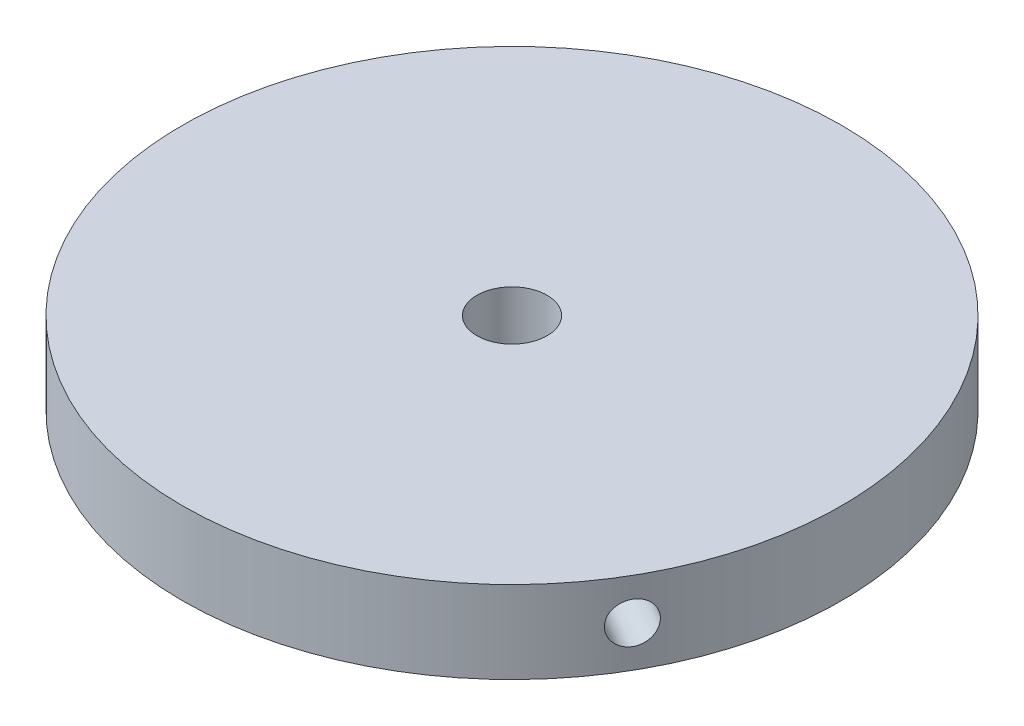
from build123d import *

# Parameters (mm, degrees)
SKETCH1_R           = 38.1508
BOSS_EXTRUDE1_DEPTH = 9.525
SKETCH4_R           = 2.3749
CUT_EXTRUDE2_DEPTH  = 6.35
CIRPATTERN1_COUNT   = 3
SKETCH6_R           = 4.064
CUT_EXTRUDE4_DEPTH  = 55.787705953


with BuildPart() as part:
    # Sketch1 → Boss-Extrude1 (new body)
    with BuildSketch(Plane(origin=(0, 0, 0), x_dir=(1, 0, 0), z_dir=(0, 1, 0))):
        Circle(SKETCH1_R)
    extrude(amount=BOSS_EXTRUDE1_DEPTH)

    # Sketch4 → Cut-Extrude2 (cut)
    with BuildSketch(Plane(origin=(-33.039561975, 0, 19.0754), x_dir=(0, -1, 0), z_dir=(-0.8660254037844433, 0, 0.49999999999999195))):
        with Locations((-4.7625, 0)):
            Circle(SKETCH4_R)
    cut_extrude2 = extrude(amount=-CUT_EXTRUDE2_DEPTH, mode=Mode.SUBTRACT)

    # CirPattern1: Cut-Extrude2 ×3 about axis
    cirpattern1_axis = Axis((0, 10.00125, 0), (0, -1, 0))
    for i in range(1, CIRPATTERN1_COUNT):
        add(cut_extrude2.rotate(cirpattern1_axis, i * 360 / CIRPATTERN1_COUNT), mode=Mode.SUBTRACT)

    # Sketch6 → Cut-Extrude4 (cut, through all)
    with BuildSketch(Plane(origin=(0, 9.525, 0), x_dir=(1, 0, 0), z_dir=(0, 1, 0))):
        Circle(SKETCH6_R)
    extrude(amount=-CUT_EXTRUDE4_DEPTH, mode=Mode.SUBTRACT)


solid = part.part
